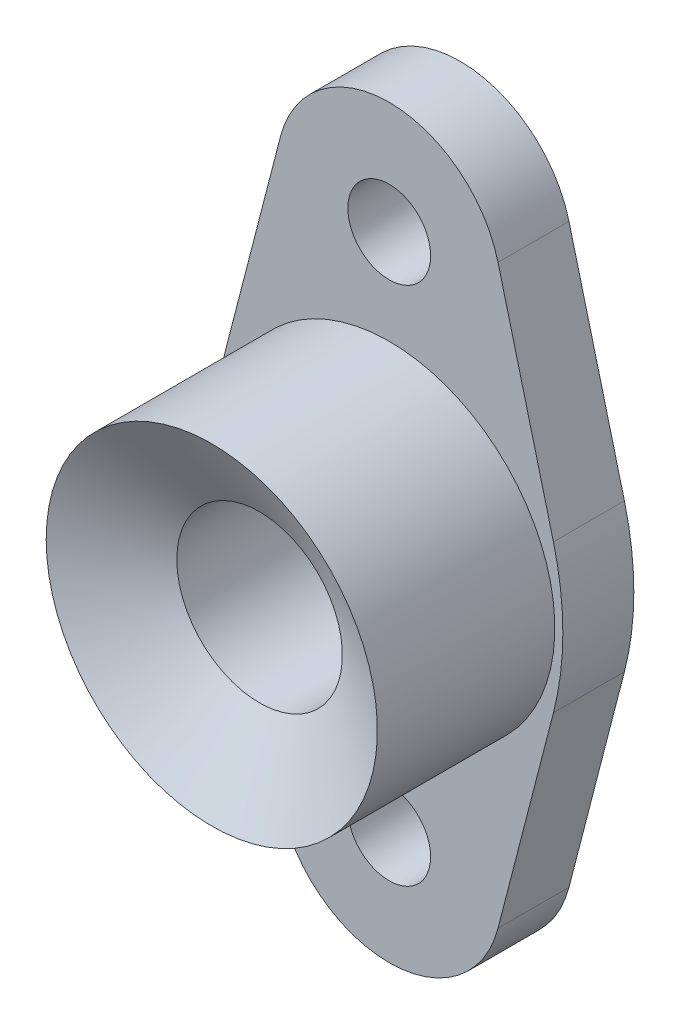
from build123d import *

# Parameters (mm, degrees)
SKETCH1_R           = 7
SKETCH1_R_2         = 14
BOSS_EXTRUDE1_DEPTH = 12
FILLET1_R           = 50


with BuildPart() as part:
    # Sketch1 → Boss-Extrude1 (new body)
    with BuildSketch(Plane.XY):
        with BuildLine():
            Line((-18.395196505, 48.755706629), (-31, 0))
            Line((-31, 0), (-18.395196505, -48.755706629))
            ThreePointArc((-18.395196505, -48.755706629), (0, -63), (18.395196505, -48.755706629))
            Line((18.395196505, -48.755706629), (31, 0))
            Line((31, 0), (18.395196505, 48.755706629))
            ThreePointArc((18.395196505, 48.755706629), (0, 63), (-18.395196505, 48.755706629))
        make_face()
        with Locations((0, 44)):
            Circle(SKETCH1_R, mode=Mode.SUBTRACT)
        with Locations((0, -44)):
            Circle(SKETCH1_R, mode=Mode.SUBTRACT)
        Circle(SKETCH1_R_2, mode=Mode.SUBTRACT)
    extrude(amount=BOSS_EXTRUDE1_DEPTH)

    # Fillet1
    fillet1_edges = [part.edges().sort_by_distance(p)[0] for p in [
        (31, 0, 6),
        (-31, 0, 6),
    ]]
    fillet(fillet1_edges, radius=FILLET1_R)

    # Sketch3 → Revolve1 (revolve)
    with BuildSketch(Plane(origin=(0, 0, 0), x_dir=(1, 0, 0), z_dir=(0, 1, 0)), mode=Mode.PRIVATE) as revolve1_sk:
        Polygon((14, -12), (28, -12), (28, -42), (14, -33.917096231), align=None)
    revolve(revolve1_sk.sketch.rotate(Axis((0, 0, -17.419804193), (0, 0, 1)), 180), axis=Axis((0, 0, -17.419804193), (0, 0, 1)))


solid = part.part
